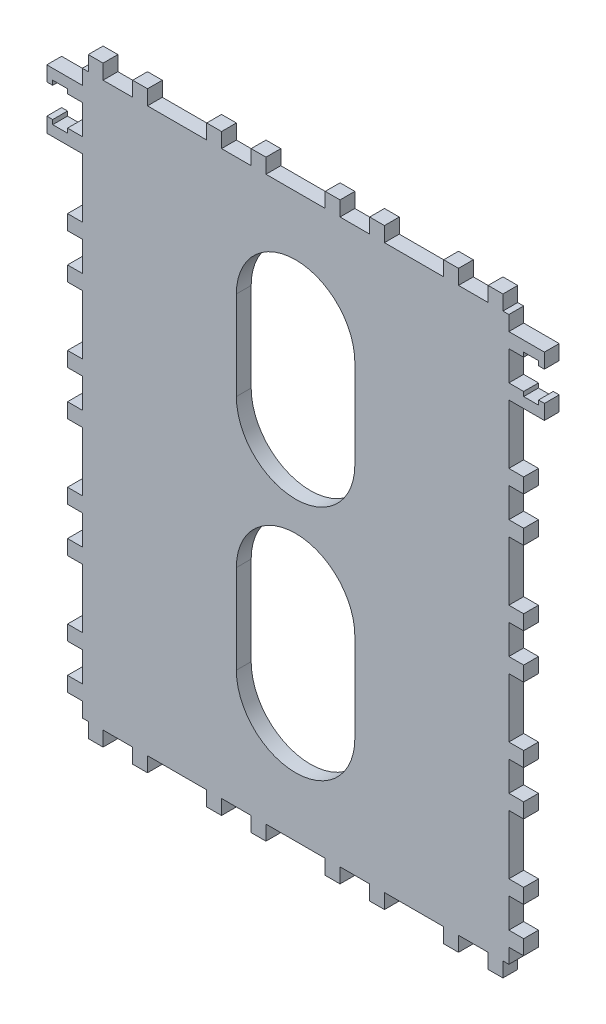
from build123d import *

# Parameters (mm, degrees)
BOSS_EXTRU_1_DEPTH = 5


with BuildPart() as part:
    # Esquisse1 → Boss.-Extru.1 (new body)
    with BuildSketch(Plane.XY):
        Polygon((-70, 190), (-72, 190), (-72, 185), (-84, 185), (-84, 180), (-82, 180), (-82, 181.5), (-77, 181.5), (-77, 180), (-72, 180), (-72, 170), (-77, 170), (-77, 168.5), (-82, 168.5), (-82, 170), (-84, 170), (-84, 165), (-72, 165), (-72, 145), (-77, 145), (-77, 140), (-72, 140), (-72, 130), (-77, 130), (-77, 125), (-72, 125), (-72, 105), (-77, 105), (-77, 100), (-72, 100), (-72, 90), (-77, 90), (-77, 85), (-72, 85), (-72, 65), (-77, 65), (-77, 60), (-72, 60), (-72, 50), (-77, 50), (-77, 45), (-72, 45), (-72, 25), (-77, 25), (-77, 20), (-72, 20), (-72, 10), (-77, 10), (-77, 5), (-72, 5), (-72, 0), (-70, 0), (-70, -5), (-65, -5), (-65, 0), (-55, 0), (-55, -5), (-50, -5), (-50, 0), (-30, 0), (-30, -5), (-25, -5), (-25, 0), (-15, 0), (-15, -5), (-10, -5), (-10, 0), (10, 0), (10, -5), (15, -5), (15, 0), (25, 0), (25, -5), (30, -5), (30, 0), (50, 0), (50, -5), (55, -5), (55, 0), (65, 0), (65, -5), (70, -5), (70, 0), (72, 0), (72, 5), (77, 5), (77, 10), (72, 10), (72, 20), (77, 20), (77, 25), (72, 25), (72, 45), (77, 45), (77, 50), (72, 50), (72, 60), (77, 60), (77, 65), (72, 65), (72, 85), (77, 85), (77, 90), (72, 90), (72, 100), (77, 100), (77, 105), (72, 105), (72, 125), (77, 125), (77, 130), (72, 130), (72, 140), (77, 140), (77, 145), (72, 145), (72, 165), (84, 165), (84, 170), (82, 170), (82, 168.5), (77, 168.5), (77, 170), (72, 170), (72, 180), (77, 180), (77, 181.5), (82, 181.5), (82, 180), (84, 180), (84, 185), (72, 185), (72, 190), (70, 190), (70, 195), (65, 195), (65, 190), (55, 190), (55, 195), (50, 195), (50, 190), (30, 190), (30, 195), (25, 195), (25, 190), (15, 190), (15, 195), (10, 195), (10, 190), (-10, 190), (-10, 195), (-15, 195), (-15, 190), (-25, 190), (-25, 195), (-30, 195), (-30, 190), (-50, 190), (-50, 195), (-55, 195), (-55, 190), (-65, 190), (-65, 195), (-70, 195), align=None)
        with BuildLine():
            ThreePointArc((20, 40), (0, 20), (-20, 40))
            Line((-20, 40), (-20, 70))
            ThreePointArc((-20, 70), (0, 90), (20, 70))
            Line((20, 70), (20, 40))
        make_face(mode=Mode.SUBTRACT)
        with BuildLine():
            ThreePointArc((20, 120), (0, 100), (-20, 120))
            Line((-20, 120), (-20, 150))
            ThreePointArc((-20, 150), (0, 170), (20, 150))
            Line((20, 150), (20, 120))
        make_face(mode=Mode.SUBTRACT)
    extrude(amount=BOSS_EXTRU_1_DEPTH)


solid = part.part
